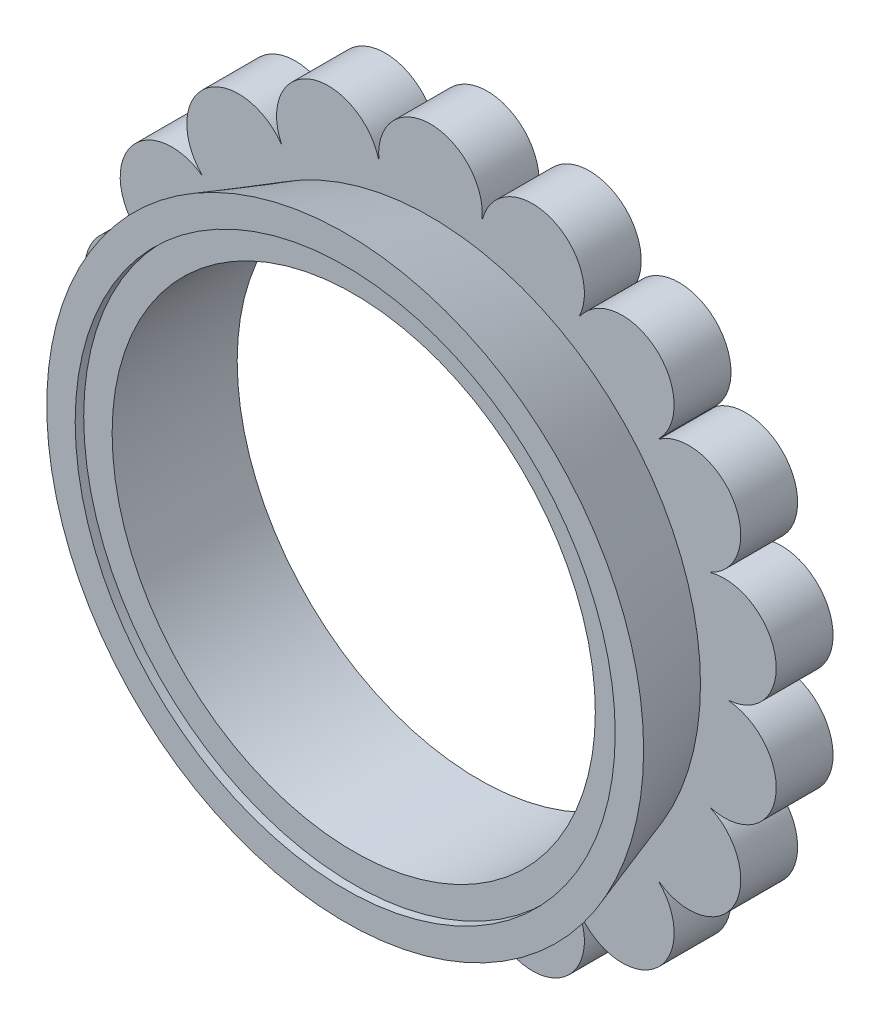
from build123d import *

# Parameters (mm, degrees)
CUT_EXTRUDE_START   = -2
SKETCH_2_R          = 13.5
CUT_EXTRUDE_3_DEPTH = 2
SKETCH_3_R          = 9.5
CUT_EXTRUDE_4_DEPTH = 0.3
CUT_EXTRUDE_START_2 = -0.3
SKETCH_4_R          = 9.5
CUT_EXTRUDE_5_DEPTH = 0.3


with BuildPart() as part:
    # 草图1 → 旋转1 (revolve)
    with BuildSketch(Plane(origin=(0, 0, 0), x_dir=(0, 0, -1), z_dir=(1, 0, 0)), mode=Mode.PRIVATE) as revolve_1_sk:
        Polygon((0, 8.5), (0, 10.5), (3, 9.5), (3, 13.5), (5, 13.5), (5, 8.5), align=None)
    revolve(revolve_1_sk.sketch.rotate(Axis((0, 0, 0), (0, 0, -1)), 90), axis=Axis((0, 0, 0), (0, 0, -1)))

    # 草图2 → 切除-拉伸3 (cut)
    with BuildSketch(Plane.XY.offset(-3).offset(CUT_EXTRUDE_START)):
        Circle(SKETCH_2_R)
        with BuildLine():
            ThreePointArc((10.499997673, 0.006991234), (10.499999418, 0.003495617), (10.5, 0))
            ThreePointArc((10.5, 0), (10.499999418, -0.003495617), (10.499997673, -0.006991234))
            ThreePointArc((10.499997673, -0.006991234), (11.684968525, -0.591722061), (12.163787272, -1.823305866))
            ThreePointArc((12.163787272, -1.823305866), (11.450680461, -3.269646883), (9.869161474, -3.584641098))
            ThreePointArc((9.869161474, -3.584641098), (9.866772518, -3.591211505), (9.864379188, -3.59778032))
            ThreePointArc((9.864379188, -3.59778032), (10.631190361, -4.270594459), (10.916572605, -5.25))
            ThreePointArc((10.916572605, -5.25), (9.935444894, -6.86715189), (8.047958748, -6.74391281))
            ThreePointArc((8.047958748, -6.74391281), (8.043466653, -6.749269902), (8.038970991, -6.754624002))
            ThreePointArc((8.038970991, -6.754624002), (8.433900995, -7.345998116), (8.572575767, -8.043466653))
            ThreePointArc((8.572575767, -8.043466653), (7.297837999, -9.782293074), (5.256053423, -9.089769107))
            ThreePointArc((5.256053423, -9.089769107), (5.25, -9.09326674), (5.24394425, -9.096760341))
            ThreePointArc((5.24394425, -9.096760341), (5.371363407, -9.472433216), (5.41451737, -9.866772518))
            ThreePointArc((5.41451737, -9.866772518), (3.829501581, -11.674440109), (1.830190483, -10.339265099))
            ThreePointArc((1.830190483, -10.339265099), (1.823305866, -10.340481407), (1.81642044, -10.34169313))
            ThreePointArc((1.81642044, -10.34169313), (1.821583696, -10.420771731), (1.823305866, -10.5))
            ThreePointArc((1.823305866, -10.5), (-0.079228269, -12.321583696), (-1.81642044, -10.34169313))
            ThreePointArc((-1.81642044, -10.34169313), (-1.823305866, -10.340481407), (-1.830190483, -10.339265099))
            ThreePointArc((-1.830190483, -10.339265099), (-4.214818838, -11.580119586), (-5.24394425, -9.096760341))
            ThreePointArc((-5.24394425, -9.096760341), (-5.25, -9.09326674), (-5.256053423, -9.089769107))
            ThreePointArc((-5.256053423, -9.089769107), (-7.921268321, -9.440199979), (-8.038970991, -6.754624002))
            ThreePointArc((-8.038970991, -6.754624002), (-8.043466653, -6.749269902), (-8.047958748, -6.74391281))
            ThreePointArc((-8.047958748, -6.74391281), (-10.672295938, -6.161652933), (-9.864379188, -3.59778032))
            ThreePointArc((-9.864379188, -3.59778032), (-9.866772518, -3.591211505), (-9.869161474, -3.584641098))
            ThreePointArc((-9.869161474, -3.584641098), (-12.136087159, -2.139919606), (-10.499997673, -0.006991234))
            ThreePointArc((-10.499997673, -0.006991234), (-10.5, 0), (-10.499997673, 0.006991234))
            ThreePointArc((-10.499997673, 0.006991234), (-12.136087159, 2.139919606), (-9.869161474, 3.584641098))
            ThreePointArc((-9.869161474, 3.584641098), (-9.866772518, 3.591211505), (-9.864379188, 3.59778032))
            ThreePointArc((-9.864379188, 3.59778032), (-10.672295938, 6.161652933), (-8.047958748, 6.74391281))
            ThreePointArc((-8.047958748, 6.74391281), (-8.043466653, 6.749269902), (-8.038970991, 6.754624002))
            ThreePointArc((-8.038970991, 6.754624002), (-7.921268321, 9.440199979), (-5.256053423, 9.089769107))
            ThreePointArc((-5.256053423, 9.089769107), (-5.25, 9.09326674), (-5.24394425, 9.096760341))
            ThreePointArc((-5.24394425, 9.096760341), (-4.214818838, 11.580119586), (-1.830190483, 10.339265099))
            ThreePointArc((-1.830190483, 10.339265099), (-1.823305866, 10.340481407), (-1.81642044, 10.34169313))
            ThreePointArc((-1.81642044, 10.34169313), (-0.079228269, 12.321583696), (1.823305866, 10.5))
            ThreePointArc((1.823305866, 10.5), (1.821583696, 10.420771731), (1.81642044, 10.34169313))
            ThreePointArc((1.81642044, 10.34169313), (1.823305866, 10.340481407), (1.830190483, 10.339265099))
            ThreePointArc((1.830190483, 10.339265099), (3.829501581, 11.674440109), (5.41451737, 9.866772518))
            ThreePointArc((5.41451737, 9.866772518), (5.371363407, 9.472433216), (5.24394425, 9.096760341))
            ThreePointArc((5.24394425, 9.096760341), (5.25, 9.09326674), (5.256053423, 9.089769107))
            ThreePointArc((5.256053423, 9.089769107), (7.297837999, 9.782293074), (8.572575767, 8.043466653))
            ThreePointArc((8.572575767, 8.043466653), (8.433900995, 7.345998116), (8.038970991, 6.754624002))
            ThreePointArc((8.038970991, 6.754624002), (8.043466653, 6.749269902), (8.047958748, 6.74391281))
            ThreePointArc((8.047958748, 6.74391281), (9.935444894, 6.86715189), (10.916572605, 5.25))
            ThreePointArc((10.916572605, 5.25), (10.631190361, 4.270594459), (9.864379188, 3.59778032))
            ThreePointArc((9.864379188, 3.59778032), (9.866772518, 3.591211505), (9.869161474, 3.584641098))
            ThreePointArc((9.869161474, 3.584641098), (11.450680461, 3.269646883), (12.163787272, 1.823305866))
            ThreePointArc((12.163787272, 1.823305866), (11.684968525, 0.591722061), (10.499997673, 0.006991234))
        make_face(mode=Mode.SUBTRACT)
    extrude(amount=CUT_EXTRUDE_3_DEPTH, mode=Mode.SUBTRACT)

    # 草图3 → 切除-拉伸4 (cut)
    with BuildSketch(Plane.XY):
        Circle(SKETCH_3_R)
    extrude(amount=-CUT_EXTRUDE_4_DEPTH, mode=Mode.SUBTRACT)

    # 草图4 → 切除-拉伸5 (cut)
    with BuildSketch(Plane(origin=(0, 0, -5), x_dir=(-1, 0, 0), z_dir=(0, 0, -1)).offset(CUT_EXTRUDE_START_2)):
        with Locations(Location((0, 0, 0), (0, 0, 180))):
            Circle(SKETCH_4_R)
    extrude(amount=CUT_EXTRUDE_5_DEPTH, mode=Mode.SUBTRACT)


solid = part.part
